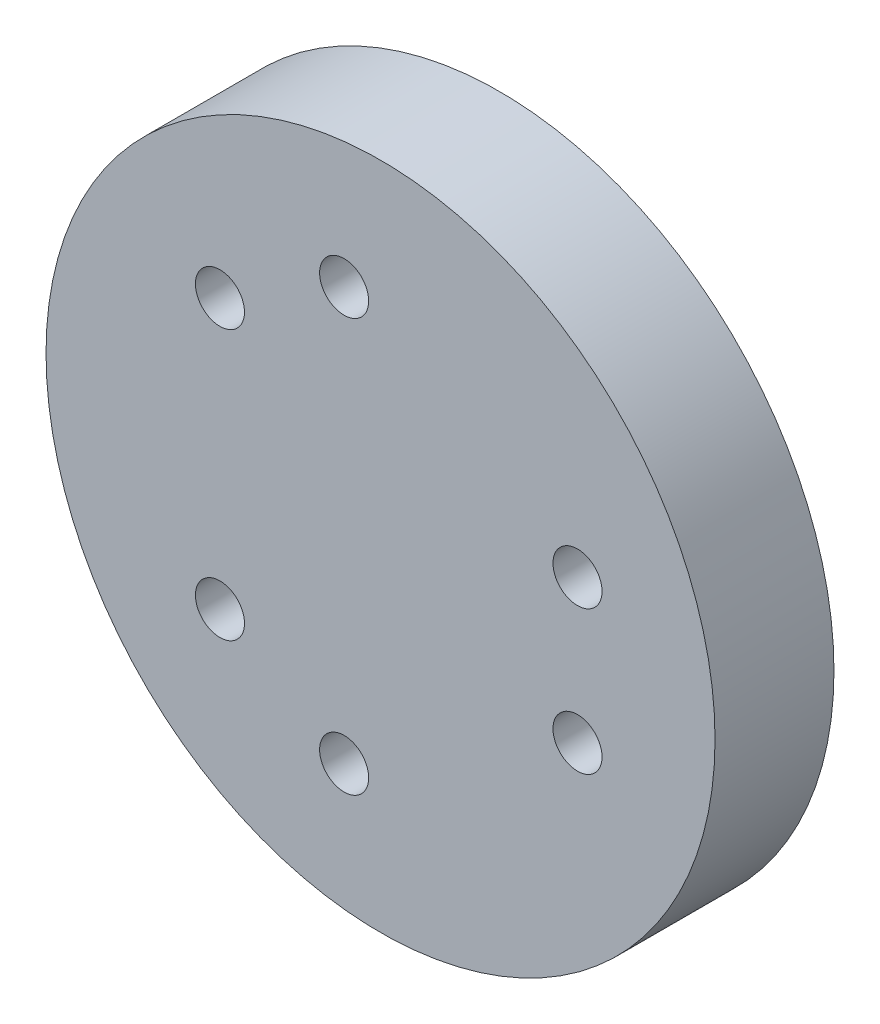
from build123d import *

# Parameters (mm, degrees)
SKETCH_1_R          = 22.5
SKETCH_1_R_2        = 1.65
EXTRUDE_1_DEPTH     = 10
SKETCH_3_R          = 3
CUT_EXTRUDE_1_DEPTH = 7
SKETCH_4_R          = 1.1
CUT_EXTRUDE_2_DEPTH = 8
SKETCH_5_R          = 22.5
SKETCH_5_R_2        = 3
SKETCH_5_R_3        = 1.1
CUT_EXTRUDE_3_DEPTH = 2
SKETCH_6_R          = 1
CUT_EXTRUDE_4_DEPTH = 2


with BuildPart() as part:
    # 스케치1 → 보스-돌출1 (new body)
    with BuildSketch(Plane.XY):
        Circle(SKETCH_1_R)
        with Locations((-2.448439305, 13.885789317)):
            Circle(SKETCH_1_R_2, mode=Mode.SUBTRACT)
        with Locations((-10.801226648, 9.063305297)):
            Circle(SKETCH_1_R_2, mode=Mode.SUBTRACT)
        with Locations((13.249665953, 4.822484021)):
            Circle(SKETCH_1_R_2, mode=Mode.SUBTRACT)
        with Locations((13.249665953, -4.822484021)):
            Circle(SKETCH_1_R_2, mode=Mode.SUBTRACT)
        with Locations((-2.448439305, -13.885789317)):
            Circle(SKETCH_1_R_2, mode=Mode.SUBTRACT)
        with Locations((-10.801226648, -9.063305297)):
            Circle(SKETCH_1_R_2, mode=Mode.SUBTRACT)
    extrude(amount=EXTRUDE_1_DEPTH)

    # 스케치3 → 컷-돌출1 (cut)
    with BuildSketch(Plane(origin=(0, 0, 0), x_dir=(-1, 0, 0), z_dir=(0, 0, -1))):
        with Locations((2.448439305, 13.885789317)):
            Circle(SKETCH_3_R)
        with Locations((10.801226648, 9.063305297)):
            Circle(SKETCH_3_R)
        with Locations((10.801226648, -9.063305297)):
            Circle(SKETCH_3_R)
        with Locations((2.448439305, -13.885789317)):
            Circle(SKETCH_3_R)
        with Locations((-13.249665953, -4.822484021)):
            Circle(SKETCH_3_R)
        with Locations((-13.249665953, 4.822484021)):
            Circle(SKETCH_3_R)
    extrude(amount=-CUT_EXTRUDE_1_DEPTH, mode=Mode.SUBTRACT)

    # 스케치4 → 컷-돌출2 (cut)
    with BuildSketch(Plane(origin=(0, 0, 0), x_dir=(-1, 0, 0), z_dir=(0, 0, -1))):
        with Locations((12.052513913, 3.314650565)):
            Circle(SKETCH_4_R)
        with Locations((12.095108511, -3.155685363)):
            Circle(SKETCH_4_R)
        with Locations((-3.155685363, -12.095108511)):
            Circle(SKETCH_4_R)
        with Locations((-8.780457946, -8.896828551)):
            Circle(SKETCH_4_R)
        with Locations((-8.896828551, 8.780457946)):
            Circle(SKETCH_4_R)
        with Locations((-3.314650565, 12.052513913)):
            Circle(SKETCH_4_R)
    extrude(amount=-CUT_EXTRUDE_2_DEPTH, mode=Mode.SUBTRACT)

    # 스케치5 → 컷-돌출3 (cut)
    with BuildSketch(Plane(origin=(0, 0, 0), x_dir=(-1, 0, 0), z_dir=(0, 0, -1))):
        Circle(SKETCH_5_R)
        with Locations((2.448439305, 13.885789317)):
            Circle(SKETCH_5_R_2, mode=Mode.SUBTRACT)
        with Locations((10.801226648, 9.063305297)):
            Circle(SKETCH_5_R_2, mode=Mode.SUBTRACT)
        with Locations((12.052513913, 3.314650565)):
            Circle(SKETCH_5_R_3, mode=Mode.SUBTRACT)
        with Locations((12.095108511, -3.155685363)):
            Circle(SKETCH_5_R_3, mode=Mode.SUBTRACT)
        with Locations((10.801226648, -9.063305297)):
            Circle(SKETCH_5_R_2, mode=Mode.SUBTRACT)
        with Locations((2.448439305, -13.885789317)):
            Circle(SKETCH_5_R_2, mode=Mode.SUBTRACT)
        with Locations((-3.155685363, -12.095108511)):
            Circle(SKETCH_5_R_3, mode=Mode.SUBTRACT)
        with Locations((-8.780457946, -8.896828551)):
            Circle(SKETCH_5_R_3, mode=Mode.SUBTRACT)
        with Locations((-13.249665953, -4.822484021)):
            Circle(SKETCH_5_R_2, mode=Mode.SUBTRACT)
        with Locations((-13.249665953, 4.822484021)):
            Circle(SKETCH_5_R_2, mode=Mode.SUBTRACT)
        with Locations((-8.896828551, 8.780457946)):
            Circle(SKETCH_5_R_3, mode=Mode.SUBTRACT)
        with Locations((-3.314650565, 12.052513913)):
            Circle(SKETCH_5_R_3, mode=Mode.SUBTRACT)
    extrude(amount=-CUT_EXTRUDE_3_DEPTH, mode=Mode.SUBTRACT)

    # 스케치6 → 컷-돌출4 (cut)
    with BuildSketch(Plane(origin=(0, 0, 2), x_dir=(-1, 0, 0), z_dir=(0, 0, -1))):
        with Locations((0, 5.6)):
            Circle(SKETCH_6_R)
        with Locations((0, -5.6)):
            Circle(SKETCH_6_R)
    extrude(amount=-CUT_EXTRUDE_4_DEPTH, mode=Mode.SUBTRACT)


solid = part.part
